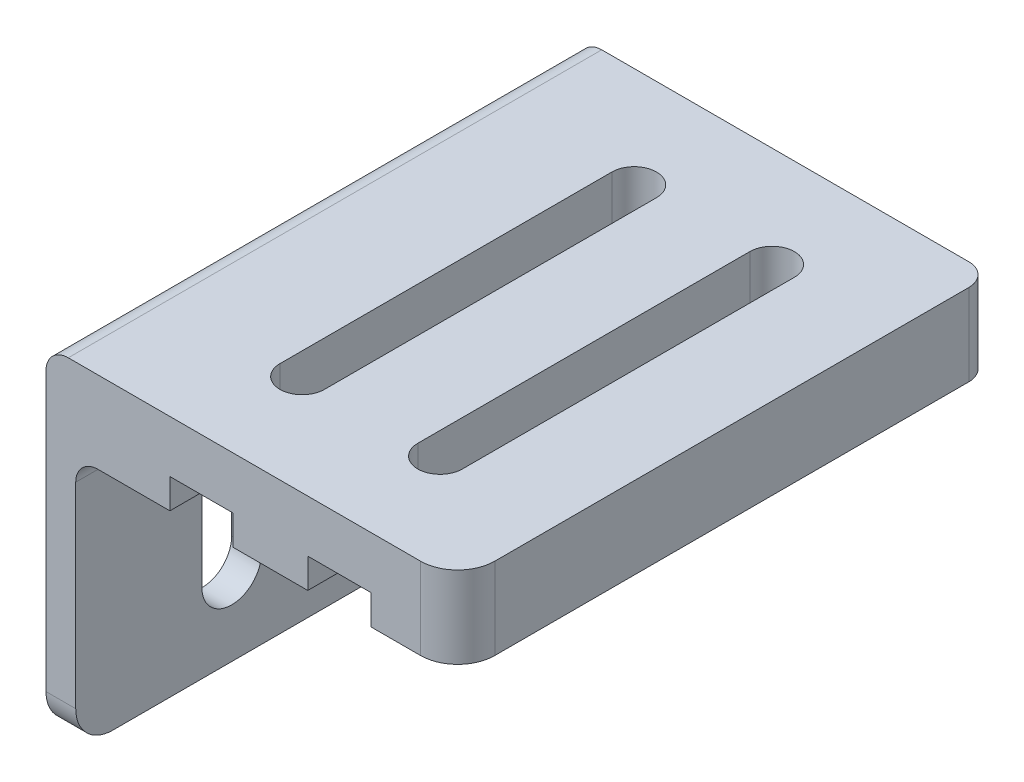
from build123d import *

# Parameters (mm, degrees)
BOSS_EXTRUDE1_START             = 0.2
SKETCH2_W                       = 41.966567091
SKETCH2_H                       = 11
SKETCH2_H_2                     = 34.4
SKETCH2_R                       = 4
SKETCH2_H_3                     = 4
BOSS_EXTRUDE1_DEPTH             = 4
BOSS_EXTRUDE2_REACH             = 197.713
SKETCH2_3_W                     = 41.966567091
SKETCH2_3_H                     = 11
SKETCH2_3_H_2                   = 4
BOSS_EXTRUDE2_DIRECTION_2_DEPTH = 60.2
FILLET1_R                       = 3
SKETCH3_W                       = 9
SKETCH3_H                       = 11.2
CUT_EXTRUDE1_DEPTH              = 24.029037182
SKETCH4_W                       = 71.659193782
SKETCH4_H                       = 19.690367256
SKETCH4_R                       = 3.18615952
BOSS_EXTRUDE3_DEPTH             = 4
FILLET2_R                       = 3
BOSS_EXTRUDE4_START             = -11
SKETCH5_W                       = 55.4
SKETCH5_H                       = 29.820392461
BOSS_EXTRUDE4_DEPTH             = 11
FILLET3_R                       = 3
CUT_EXTRUDE2_DEPTH              = 258.572392856
CUT_EXTRUDE2_DEPTH_BACK         = 258.572392856
SKETCH7_W                       = 8.5
SKETCH7_H                       = 4
FILLET6_R                       = 2
CUT_EXTRUDE3_REACH              = 172.81
CUT_EXTRUDE4_DEPTH              = 174.523300181
CUT_EXTRUDE4_DEPTH_BACK         = 174.523300181
FILLET7_R                       = 5
BOSS_EXTRUDE5_START             = -4
SKETCH10_W                      = 29.820392461
SKETCH10_H                      = 34.4
BOSS_EXTRUDE5_DEPTH             = 4
BOSS_EXTRUDE6_START             = 29.82039246
BOSS_EXTRUDE6_DEPTH             = 29.82039246
CUT_EXTRUDE5_DEPTH              = 210.306605099
CUT_EXTRUDE5_DEPTH_BACK         = 210.306605099
CUT_EXTRUDE6_DEPTH              = 210.306605099
CUT_EXTRUDE6_DEPTH_BACK         = 210.306605099
SKETCH15_W                      = 78.727492145
SKETCH15_H                      = 13.85710387
CUT_EXTRUDE8_REACH              = 163.596
SKETCH16_W                      = 13.433327452
SKETCH16_H                      = 52.832089958
FILLET8_R                       = 5


with BuildPart() as part:
    # Sketch2 → Boss-Extrude1 (new body)
    # profile 1 of 3: a face of its own
    with BuildSketch(Plane.ZY.offset(-93.4).offset(BOSS_EXTRUDE1_START)):
        with Locations((5.257762951, -150)):
            Rectangle(SKETCH2_W, SKETCH2_H)
    # profile 2 of 3: a face of its own
    with BuildSketch(Plane.ZY.offset(-93.4).offset(BOSS_EXTRUDE1_START)):
        with Locations((5.257762951, -172.7)):
            Rectangle(SKETCH2_W, SKETCH2_H_2)
        with Locations((5.257762951, -173.849326746)):
            Circle(SKETCH2_R, mode=Mode.SUBTRACT)
    # profile 3 of 3: a face of its own
    with BuildSketch(Plane.ZY.offset(-93.4).offset(BOSS_EXTRUDE1_START)):
        with Locations((5.257762951, -191.9)):
            Rectangle(SKETCH2_W, SKETCH2_H_3)
    extrude(amount=BOSS_EXTRUDE1_DEPTH)

    # Sketch2<3> → Boss-Extrude2 (add, up to next)
    with BuildSketch(Plane.ZY.offset(-93.4), mode=Mode.PRIVATE) as boss_extrude2_sk1:
        with Locations((5.257762951, -150)):
            Rectangle(SKETCH2_3_W, SKETCH2_3_H)
    boss_extrude2_tool1 = extrude(boss_extrude2_sk1.sketch, amount=BOSS_EXTRUDE2_REACH, mode=Mode.PRIVATE) - part.part
    # Sketch2<3> → Boss-Extrude2 (add, up to next)
    with BuildSketch(Plane.ZY.offset(-93.4), mode=Mode.PRIVATE) as boss_extrude2_sk2:
        with Locations((5.257762951, -191.9)):
            Rectangle(SKETCH2_3_W, SKETCH2_3_H_2)
    boss_extrude2_tool2 = extrude(boss_extrude2_sk2.sketch, amount=BOSS_EXTRUDE2_REACH, mode=Mode.PRIVATE) - part.part
    add(boss_extrude2_tool1.solids().sort_by_distance((93.4, -150, 5.257763))[0])
    add(boss_extrude2_tool2.solids().sort_by_distance((93.4, -191.9, 5.257763))[0])

    # Sketch2<3> → Boss-Extrude2 direction 2 (add)
    with BuildSketch(Plane.ZY.offset(-93.4)):
        with Locations((5.257762951, -150)):
            Rectangle(SKETCH2_3_W, SKETCH2_3_H)
        with Locations((5.257762951, -191.9)):
            Rectangle(SKETCH2_3_W, SKETCH2_3_H_2)
    extrude(amount=-BOSS_EXTRUDE2_DIRECTION_2_DEPTH)

    # Fillet1
    fillet1_edges = [part.edges().sort_by_distance(p)[0] for p in [
        (89.2, -193.9, 5.257762951),
        (93.2, -155.5, 5.257762951),
        (153.6, -191.9, 26.241046496),
        (93.2, -189.9, 5.257762951),
        (153.6, -191.9, -15.725520595),
    ]]
    fillet(fillet1_edges, radius=FILLET1_R)

    # Sketch3 → Cut-Extrude1 (cut)
    with BuildSketch(Plane.XY.offset(26.241046496)):
        with Locations((149.1, -150.1)):
            Rectangle(SKETCH3_W, SKETCH3_H)
    extrude(amount=-CUT_EXTRUDE1_DEPTH, mode=Mode.SUBTRACT)

    # Sketch4 → Boss-Extrude3 (add)
    with BuildSketch(Plane(origin=(153.6, 0, 0), x_dir=(0, 0, -1), z_dir=(1, 0, 0))):
        with Locations((-20.104076296, -145.654816372)):
            Rectangle(SKETCH4_W, SKETCH4_H)
        with Locations((-39.297424086, -145.700936153)):
            Circle(SKETCH4_R, mode=Mode.SUBTRACT)
        with Locations((-9.68615952, -145.700936153)):
            Circle(SKETCH4_R, mode=Mode.SUBTRACT)
    extrude(amount=-BOSS_EXTRUDE3_DEPTH)

    # Fillet2
    fillet2_edges = [part.edges().sort_by_distance(p)[0] for p in [
        (149.6, -144.5, -6.75675564),
        (151.6, -135.809632744, -15.725520595),
        (151.6, -135.809632744, 55.933673187),
    ]]
    fillet(fillet2_edges, radius=FILLET2_R)

    # Sketch5 → Boss-Extrude4 (add)
    with BuildSketch(Plane(origin=(0, -144.5, 0), x_dir=(1, 0, 0), z_dir=(0, 1, 0)).offset(BOSS_EXTRUDE4_START)):
        with Locations((116.9, -41.151242727)):
            Rectangle(SKETCH5_W, SKETCH5_H)
    extrude(amount=BOSS_EXTRUDE4_DEPTH)

    # Fillet3
    fillet3_edges = [part.edges().sort_by_distance(p)[0] for p in [
        (144.6, -150, 56.061438957),
        (89.2, -144.5, 20.167959181),
    ]]
    fillet(fillet3_edges, radius=FILLET3_R)

    # Sketch7 → Cut-Extrude2 (cut, two sides: drawn at the far end of the back side and taken through both)
    with BuildSketch(Plane(origin=(0, 0, -15.725520595), x_dir=(-1, 0, 0), z_dir=(0, 0, -1)).offset(-CUT_EXTRUDE2_DEPTH_BACK)):
        with Locations((-128.677790471, -153.5)):
            Rectangle(SKETCH7_W, SKETCH7_H)
        with Locations((-110.122209529, -153.5)):
            Rectangle(SKETCH7_W, SKETCH7_H)
    extrude(amount=CUT_EXTRUDE2_DEPTH + CUT_EXTRUDE2_DEPTH_BACK, mode=Mode.SUBTRACT)

    # Fillet6
    fillet6_edges = [part.edges().sort_by_distance(p)[0] for p in [
        (144.6, -150, 2.212009314),
    ]]
    fillet(fillet6_edges, radius=FILLET6_R)

    # Sketch8 → Cut-Extrude3 (cut, up to next)
    with BuildSketch(Plane(origin=(0, -144.5, 0), x_dir=(1, 0, 0), z_dir=(0, 1, 0)), mode=Mode.PRIVATE) as cut_extrude3_sk1:
        with BuildLine():
            Line((113.122209529, 2.172515143), (113.122209529, -42.508433505))
            ThreePointArc((113.122209529, -42.508433505), (110.122209529, -45.508433505), (107.122209529, -42.508433505))
            Line((107.122209529, -42.508433505), (107.122209529, 2.172515143))
            ThreePointArc((107.122209529, 2.172515143), (110.122209529, 5.172515143), (113.122209529, 2.172515143))
        make_face()
    cut_extrude3_tool1 = extrude(cut_extrude3_sk1.sketch, amount=-CUT_EXTRUDE3_REACH, mode=Mode.PRIVATE) & part.part
    # Sketch8 → Cut-Extrude3 (cut, up to next)
    with BuildSketch(Plane(origin=(0, -144.5, 0), x_dir=(1, 0, 0), z_dir=(0, 1, 0)), mode=Mode.PRIVATE) as cut_extrude3_sk2:
        with BuildLine():
            Line((125.677790471, 2.172515143), (125.677790471, -42.508433505))
            ThreePointArc((125.677790471, -42.508433505), (128.677790471, -45.508433505), (131.677790471, -42.508433505))
            Line((131.677790471, -42.508433505), (131.677790471, 2.172515143))
            ThreePointArc((131.677790471, 2.172515143), (128.677790471, 5.172515143), (125.677790471, 2.172515143))
        make_face()
    cut_extrude3_tool2 = extrude(cut_extrude3_sk2.sketch, amount=-CUT_EXTRUDE3_REACH, mode=Mode.PRIVATE) & part.part
    add(cut_extrude3_tool1.solids().sort_by_distance((110.12221, -144.5, 20.167959))[0], mode=Mode.SUBTRACT)
    add(cut_extrude3_tool2.solids().sort_by_distance((128.67779, -144.5, 20.167959))[0], mode=Mode.SUBTRACT)

    # Sketch9 → Cut-Extrude4 (cut, two sides: drawn at the far end of the back side and taken through both)
    with BuildSketch(Plane(origin=(0, -135.809632744, 0), x_dir=(1, 0, 0), z_dir=(0, 1, 0)).offset(-CUT_EXTRUDE4_DEPTH_BACK)):
        Polygon((144.6, 47.11572478), (144.6, -77.58184164), (185.54461202, -56.674351197), (190.182137353, 46.607841752), align=None)
    extrude(amount=CUT_EXTRUDE4_DEPTH + CUT_EXTRUDE4_DEPTH_BACK, mode=Mode.SUBTRACT)

    # Fillet7
    fillet7_edges = [part.edges().sort_by_distance(p)[0] for p in [
        (144.6, -150, -15.725520595),
    ]]
    fillet(fillet7_edges, radius=FILLET7_R)

    # Sketch10 → Boss-Extrude5 (add)
    with BuildSketch(Plane.ZY.offset(-89.2).offset(BOSS_EXTRUDE5_START)):
        with Locations((41.151242727, -172.7)):
            Rectangle(SKETCH10_W, SKETCH10_H)
    extrude(amount=BOSS_EXTRUDE5_DEPTH)

    # Sketch11 → Boss-Extrude6 (add)
    with BuildSketch(Plane.XY.offset(26.241046496).offset(BOSS_EXTRUDE6_START)):
        with BuildLine():
            Line((93.2, -155.5), (93.2, -158.5))
            ThreePointArc((93.2, -158.5), (94.078679656, -156.378679656), (96.2, -155.5))
            Line((96.2, -155.5), (93.2, -155.5))
        make_face()
    extrude(amount=-BOSS_EXTRUDE6_DEPTH)

    # Sketch14 → Cut-Extrude5 (cut, two sides: drawn at the far end of the back side and taken through both)
    with BuildSketch(Plane.ZY.offset(-89.2).offset(-CUT_EXTRUDE5_DEPTH_BACK)):
        with BuildLine():
            Line((9.257762951, -168.408548592), (9.257762951, -179.290104899))
            ThreePointArc((9.257762951, -179.290104899), (5.257762951, -183.290104899), (1.257762951, -179.290104899))
            Line((1.257762951, -179.290104899), (1.257762951, -168.408548592))
            ThreePointArc((1.257762951, -168.408548592), (5.257762951, -164.408548592), (9.257762951, -168.408548592))
        make_face()
    extrude(amount=CUT_EXTRUDE5_DEPTH + CUT_EXTRUDE5_DEPTH_BACK, mode=Mode.SUBTRACT)

    # Sketch15 → Cut-Extrude6 (cut, two sides: drawn at the far end of the back side and taken through both)
    with BuildSketch(Plane.ZY.offset(-89.2).offset(-CUT_EXTRUDE6_DEPTH_BACK)):
        with Locations((22.135388596, -196.828551935)):
            Rectangle(SKETCH15_W, SKETCH15_H)
    extrude(amount=CUT_EXTRUDE6_DEPTH + CUT_EXTRUDE6_DEPTH_BACK, mode=Mode.SUBTRACT)

    # Sketch16 → Cut-Extrude8 (cut, up to next)
    with BuildSketch(Plane.XZ.offset(189.9), mode=Mode.PRIVATE) as cut_extrude8_sk1:
        with Locations((99.916663726, 10.690524384)):
            Rectangle(SKETCH16_W, SKETCH16_H)
    cut_extrude8_tool1 = extrude(cut_extrude8_sk1.sketch, amount=-CUT_EXTRUDE8_REACH, mode=Mode.PRIVATE) & part.part
    add(cut_extrude8_tool1.solids().sort_by_distance((99.916664, -189.9, 10.690524))[0], mode=Mode.SUBTRACT)

    # Fillet8
    fillet8_edges = [part.edges().sort_by_distance(p)[0] for p in [
        (91.2, -189.9, 56.061438957),
        (91.2, -189.9, -15.725520595),
    ]]
    fillet(fillet8_edges, radius=FILLET8_R)


with BuildPart() as body_2:
    # Mirror1: mirrored copy
    add(part.part.mirror(Plane(origin=(144.6, -155.5, 56.061438957), x_dir=(1, 0, 0), z_dir=(0, 0, 1))))


solid = body_2.part
